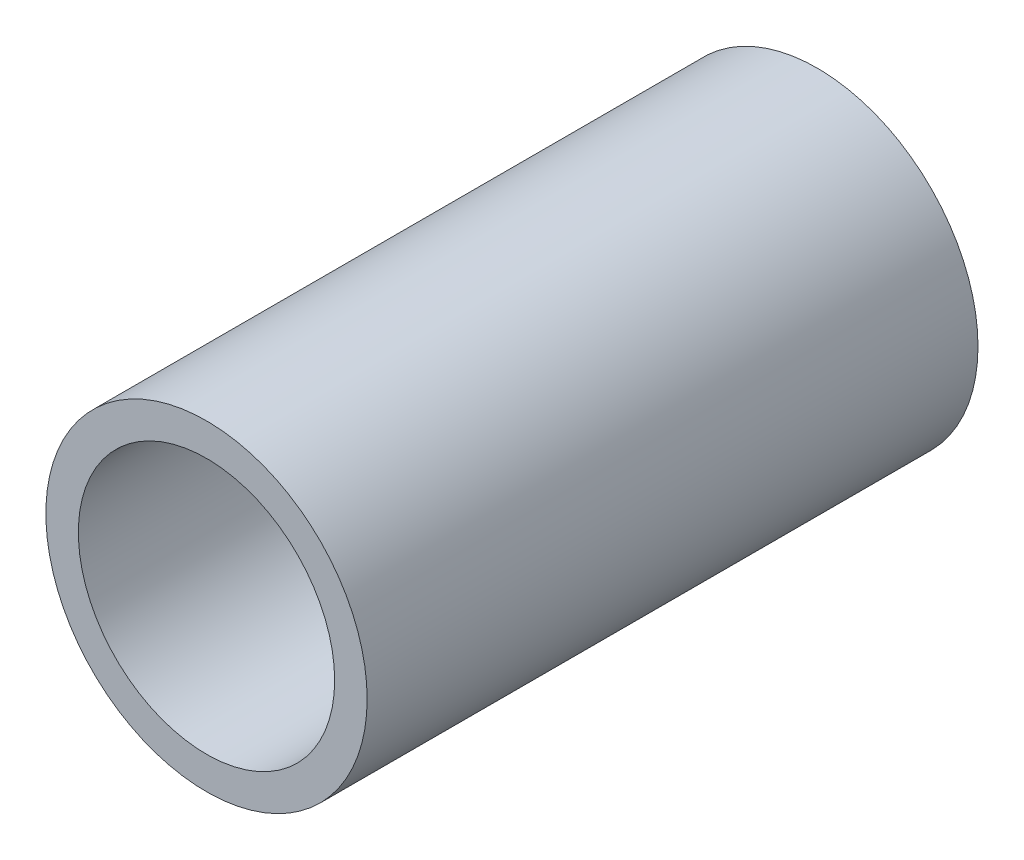
from build123d import *

# Parameters (mm, degrees)
SKETCH1_R           = 16.7005
SKETCH1_R_2         = 13.3223
EXTRUDE_THIN1_DEPTH = 31.75


with BuildPart() as part:
    # Sketch1 → Extrude-Thin1 (new, symmetric)
    with BuildSketch(Plane.XY):
        Circle(SKETCH1_R)
        Circle(SKETCH1_R_2, mode=Mode.SUBTRACT)
    extrude(amount=EXTRUDE_THIN1_DEPTH, both=True)


solid = part.part
